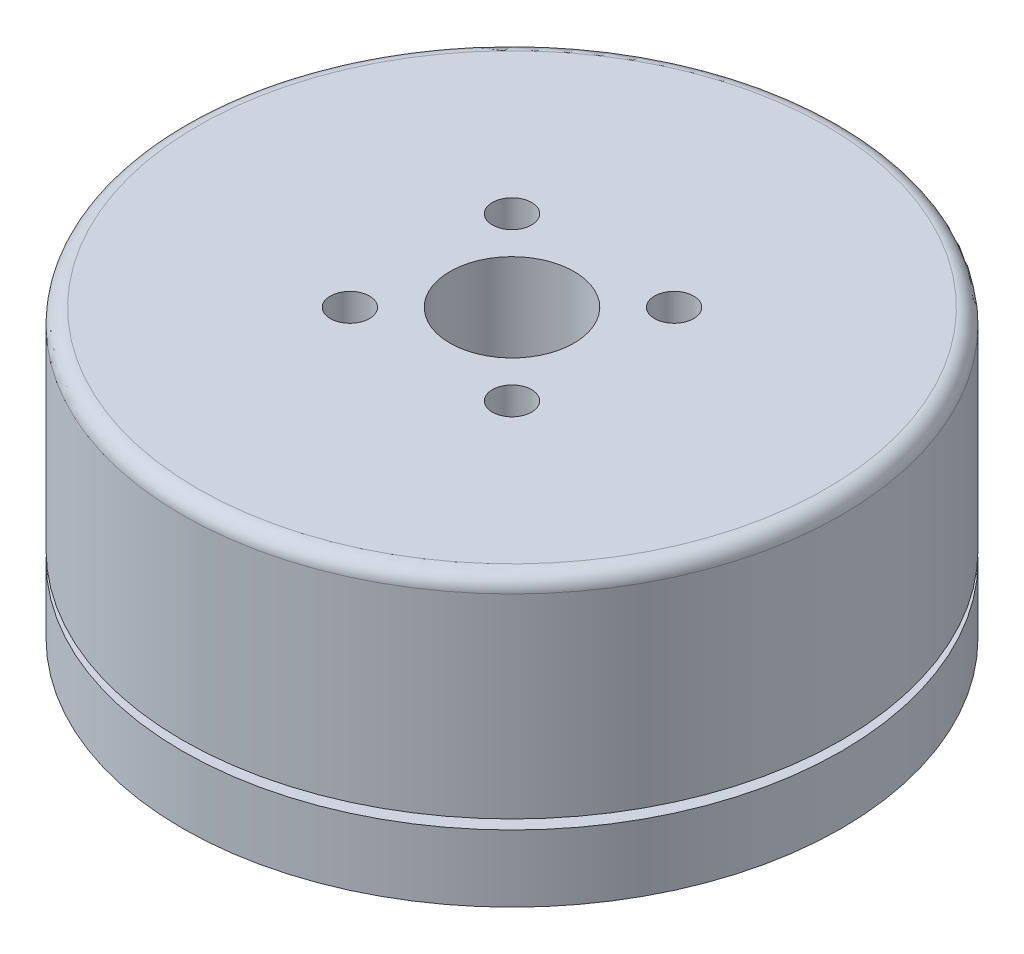
from build123d import *

# Parameters (mm, degrees)
CUT_EXTRUDE_START        = -4
SKETCH_4_R               = 17.25
SKETCH_4_R_2             = 16.25
CUT_EXTRUDE_1_DEPTH      = 0.5
HOLE_WIZARD_M2_5_2_D     = 2.05
HOLE_WIZARD_M2_5_2_DEPTH = 3.5
HOLE_WIZARD_M2_5_2_TIP   = 0.615882135
SKETCH_9_W               = 5.8
SKETCH_9_H               = 1.5
EXTRUDE_1_DEPTH          = 4
HOLE_WIZARD_M2_5_1_D     = 2.05
HOLE_WIZARD_M2_5_1_DEPTH = 3.5
HOLE_WIZARD_M2_5_1_TIP   = 0.615882135
FILLET_1_R               = 0.8
SKETCH_14_R              = 4
CUT_EXTRUDE_1_2_DEPTH    = 1.3


with BuildPart() as part:
    # 草图1 → 旋转1 (revolve)
    with BuildSketch(Plane.XY, mode=Mode.PRIVATE) as revolve_1_sk:
        Polygon((-6, 0), (-6, 1.62), (-17.25, 1.62), (-17.25, 16.62), (-3.25, 16.62), (-3.25, 0), align=None)
    revolve(revolve_1_sk.sketch.rotate(Axis((0, 44.719290515, 0), (0, -1, 0)), 270), axis=Axis((0, 44.719290515, 0), (0, -1, 0)))

    # 草图4 → Cut-Extrude 1 (cut)
    with BuildSketch(Plane.XZ.offset(-1.62).offset(CUT_EXTRUDE_START)):
        Circle(SKETCH_4_R)
        Circle(SKETCH_4_R_2, mode=Mode.SUBTRACT)
    extrude(amount=CUT_EXTRUDE_1_DEPTH, mode=Mode.SUBTRACT)

    # M2.5 螺纹孔2
    with Locations(Plane(origin=(0, 1.62, 0), x_dir=(-1, 0, 0), z_dir=(0, -1, 0))):
        with Locations((-6.717514421, 6.717514421), (-6.717514421, -6.717514421), (6.717514421, -6.717514421), (6.717514421, 6.717514421)):
            Hole(HOLE_WIZARD_M2_5_2_D / 2, depth=HOLE_WIZARD_M2_5_2_DEPTH)
            with Locations((0, 0, -(HOLE_WIZARD_M2_5_2_DEPTH + HOLE_WIZARD_M2_5_2_TIP / 2))):  # 118° drill point
                Cone(0, HOLE_WIZARD_M2_5_2_D / 2, HOLE_WIZARD_M2_5_2_TIP, mode=Mode.SUBTRACT)

    # 草图9 → 凸台-拉伸1 (add)
    with BuildSketch(Plane.XZ.offset(-1.62)):
        with Locations((0, -14.5)):
            Rectangle(SKETCH_9_W, SKETCH_9_H)
    extrude(amount=EXTRUDE_1_DEPTH)

    # M2.5 螺纹孔1
    with Locations(Plane(origin=(0, 16.62, 0), x_dir=(1, 0, 0), z_dir=(0, 1, 0))):
        with Locations((-4.242640687, 4.242640687), (4.242640687, 4.242640687), (4.242640687, -4.242640687), (-4.242640687, -4.242640687)):
            Hole(HOLE_WIZARD_M2_5_1_D / 2, depth=HOLE_WIZARD_M2_5_1_DEPTH)
            with Locations((0, 0, -(HOLE_WIZARD_M2_5_1_DEPTH + HOLE_WIZARD_M2_5_1_TIP / 2))):  # 118° drill point
                Cone(0, HOLE_WIZARD_M2_5_1_D / 2, HOLE_WIZARD_M2_5_1_TIP, mode=Mode.SUBTRACT)

    # 圆角1
    fillet_1_edges = [part.edges().sort_by_distance(p)[0] for p in [
        (0, 16.62, -17.25),
    ]]
    fillet(fillet_1_edges, radius=FILLET_1_R)

    # 草图14 → Cut-Extrude 1 2 (cut)
    with BuildSketch(Plane.XZ):
        with Locations(Location((0, 0, 0), (0, 0, 270))):
            Circle(SKETCH_14_R)
    extrude(amount=-CUT_EXTRUDE_1_2_DEPTH, mode=Mode.SUBTRACT)


solid = part.part
